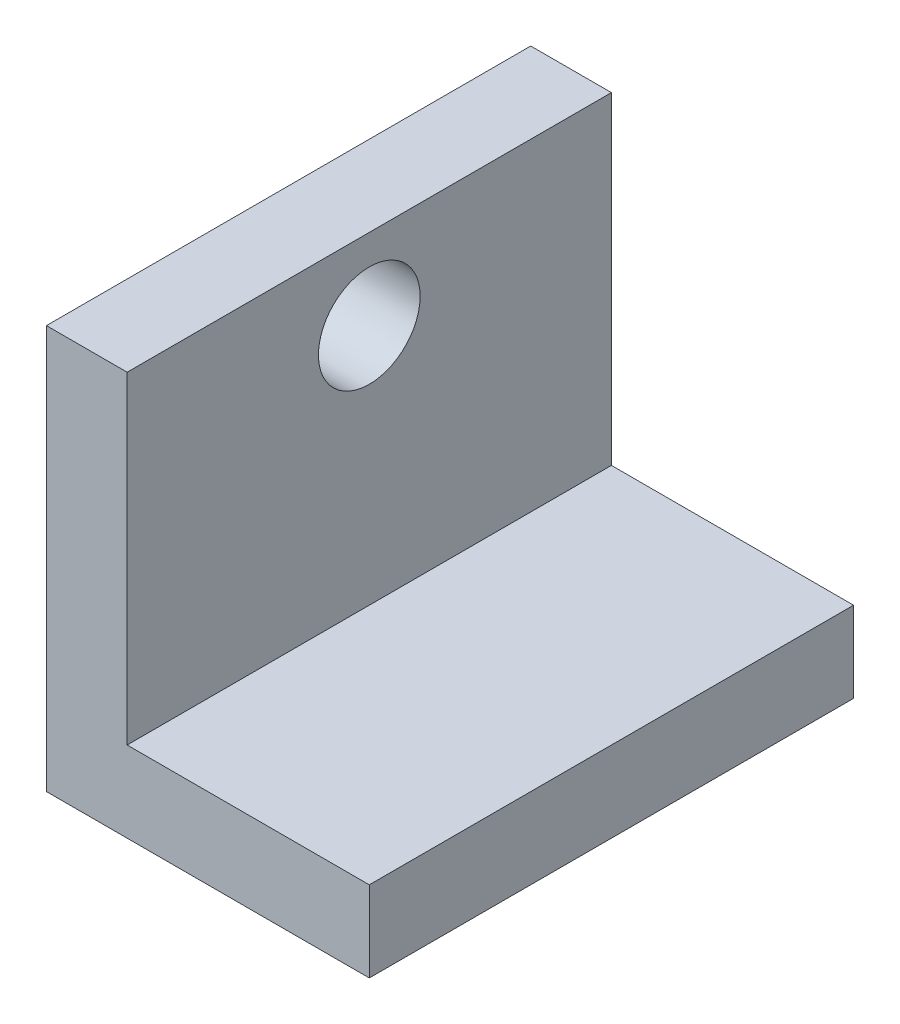
from build123d import *

# Parameters (mm, degrees)
SKETCH1_W           = 9.525
SKETCH1_H           = 19.05
SKETCH1_W_2         = 3.175
BOSS_EXTRUDE1_DEPTH = 3.175
BOSS_EXTRUDE2_START = 3.175
SKETCH1_3_W         = 3.175
SKETCH1_3_H         = 19.05
BOSS_EXTRUDE2_DEPTH = 12.7
SKETCH2_R           = 2
CUT_EXTRUDE1_DEPTH  = 21.819867315


with BuildPart() as part:
    # Sketch1 → Boss-Extrude1 (new body)
    with BuildSketch(Plane(origin=(0, 0, 0), x_dir=(1, 0, 0), z_dir=(0, 1, 0))):
        with Locations((1.5875, 0)):
            Rectangle(SKETCH1_W, SKETCH1_H)
        with Locations((-4.7625, 0)):
            Rectangle(SKETCH1_W_2, SKETCH1_H)
    extrude(amount=BOSS_EXTRUDE1_DEPTH)

    # Sketch1<3> → Boss-Extrude2 (add)
    with BuildSketch(Plane(origin=(0, 0, 0), x_dir=(1, 0, 0), z_dir=(0, 1, 0)).offset(BOSS_EXTRUDE2_START)):
        with Locations((-4.7625, 0)):
            Rectangle(SKETCH1_3_W, SKETCH1_3_H)
    extrude(amount=BOSS_EXTRUDE2_DEPTH)

    # Sketch2 → Cut-Extrude1 (cut, through all)
    with BuildSketch(Plane(origin=(-3.175, 0, 0), x_dir=(0, 0, -1), z_dir=(1, 0, 0))):
        with Locations((0, 12.7)):
            Circle(SKETCH2_R)
    extrude(amount=-CUT_EXTRUDE1_DEPTH, mode=Mode.SUBTRACT)


solid = part.part
